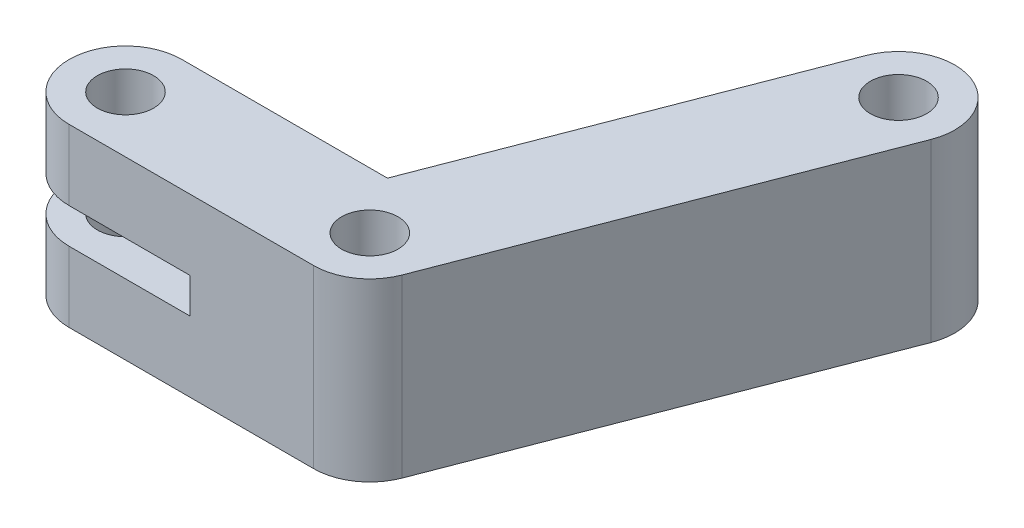
from build123d import *

# Parameters (mm, degrees)
SKETCH_1_R          = 4
EXTRUDE_1_DEPTH     = 12.5
SKETCH_2_W          = 25.15
SKETCH_2_H          = 5
CUT_EXTRUDE_1_DEPTH = 16


with BuildPart() as part:
    # 草图1 → 凸台-拉伸1 (new, symmetric)
    with BuildSketch(Plane(origin=(0, 0, 0), x_dir=(1, 0, 0), z_dir=(0, 1, 0))):
        with BuildLine():
            Line((0, 8), (29.228297239, 8))
            Line((29.228297239, 8), (48.144548452, 57.11524489))
            ThreePointArc((48.144548452, 57.11524489), (58.48524489, 61.705451548), (63.075451548, 51.36475511))
            Line((63.075451548, 51.36475511), (42.185451548, -2.87524489))
            ThreePointArc((42.185451548, -2.87524489), (39.247584393, -6.595527239), (34.72, -8))
            Line((34.72, -8), (0, -8))
            ThreePointArc((0, -8), (-8, 0), (0, 8))
        make_face()
        with Locations(Location((0, 0, 0), (0, 0, 270))):
            Circle(SKETCH_1_R, mode=Mode.SUBTRACT)
        with Locations(Location((34.72, 0, 0), (0, 0, 270))):
            Circle(SKETCH_1_R, mode=Mode.SUBTRACT)
        with Locations(Location((55.61, 54.24, 0), (0, 0, 270))):
            Circle(SKETCH_1_R, mode=Mode.SUBTRACT)
    extrude(amount=EXTRUDE_1_DEPTH, both=True)

    # 草图2 → 切除-拉伸1 (cut)
    with BuildSketch(Plane.XY.offset(8)):
        with Locations((4.575, 0)):
            Rectangle(SKETCH_2_W, SKETCH_2_H)
    extrude(amount=-CUT_EXTRUDE_1_DEPTH, mode=Mode.SUBTRACT)


solid = part.part
